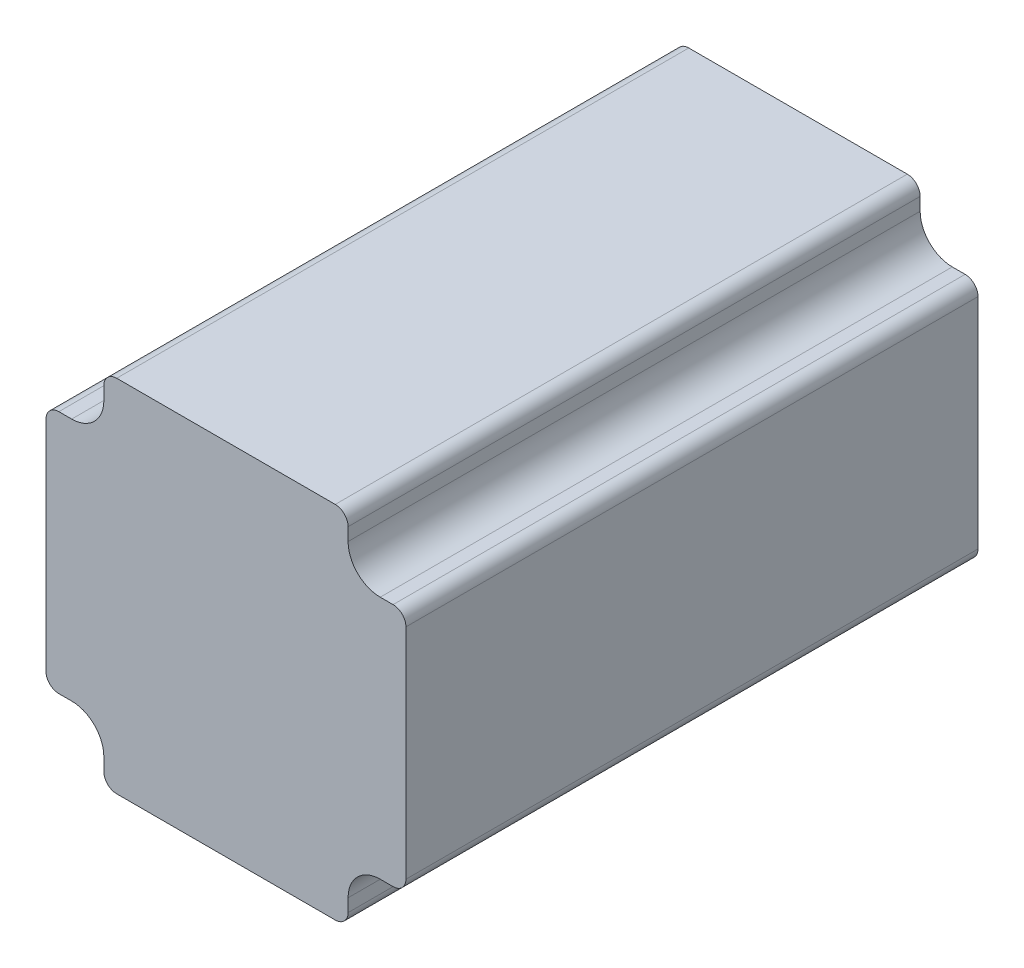
from build123d import *

# Parameters (mm, degrees)
SKETCH1_W           = 56
SKETCH1_H           = 56
BOSS_EXTRUDE1_DEPTH = 89
SKETCH2_W           = 9
SKETCH2_H           = 9
CUT_EXTRUDE1_DEPTH  = 89
CIRPATTERN1_COUNT   = 4
FILLET1_R           = 5
FILLET2_R           = 2


with BuildPart() as part:
    # Sketch1 → Boss-Extrude1 (new body)
    with BuildSketch(Plane.XY):
        Rectangle(SKETCH1_W, SKETCH1_H)
    extrude(amount=BOSS_EXTRUDE1_DEPTH)

    # Sketch2 → Cut-Extrude1 (cut)
    with BuildSketch(Plane.XY.offset(89)):
        with Locations((23.5, 23.5)):
            Rectangle(SKETCH2_W, SKETCH2_H)
    cut_extrude1 = extrude(amount=-CUT_EXTRUDE1_DEPTH, mode=Mode.SUBTRACT)

    # CirPattern1: Cut-Extrude1 ×4 about axis
    cirpattern1_axis = Axis((0, 0, -4.45), (0, 0, 1))
    for i in range(1, CIRPATTERN1_COUNT):
        add(cut_extrude1.rotate(cirpattern1_axis, i * 360 / CIRPATTERN1_COUNT), mode=Mode.SUBTRACT)

    # Fillet1
    fillet1_edges = [part.edges().sort_by_distance(p)[0] for p in [
        (19, 19, 44.5),
        (-19, 19, 44.5),
        (-19, -19, 44.5),
        (19, -19, 44.5),
    ]]
    fillet(fillet1_edges, radius=FILLET1_R)

    # Fillet2
    fillet2_edges = [part.edges().sort_by_distance(p)[0] for p in [
        (19, 28, 44.5),
        (28, 19, 44.5),
        (28, -19, 44.5),
        (19, -28, 44.5),
        (-19, -28, 44.5),
        (-28, -19, 44.5),
        (-28, 19, 44.5),
        (-19, 28, 44.5),
    ]]
    fillet(fillet2_edges, radius=FILLET2_R)


solid = part.part
